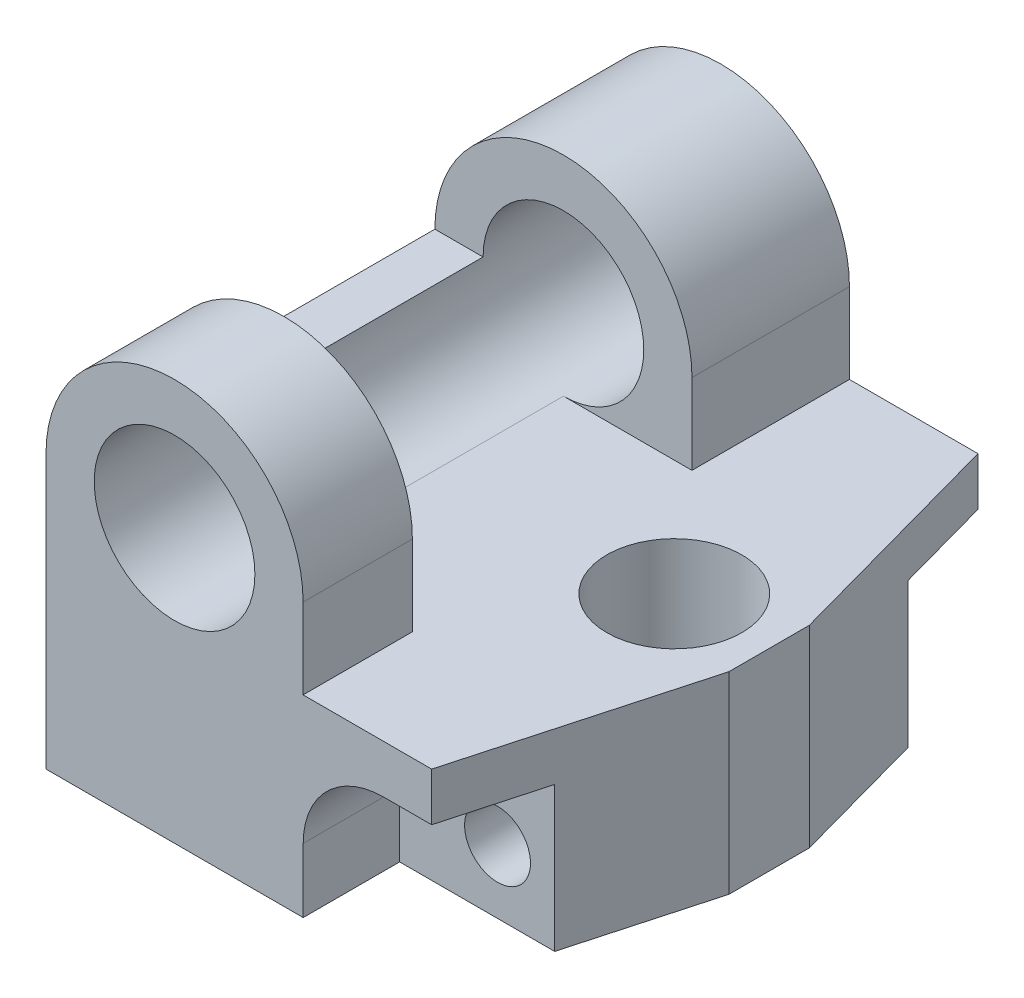
from build123d import *

# Parameters (mm, degrees)
SKETCH_1_R                = 2.5
EXTRUDE_1_DEPTH           = 8.5
CUT_EXTRUDE_1_DEPTH       = 17
CUT_EXTRUDE_2_DEPTH       = 3
FILLET_1_R                = 2.5
FILLET_1_OF_MIRROR_1_R    = 2.5
CUT_EXTRUDE_3_REACH       = 19.621
SKETCH_4_R                = 2.1
HOLE_WIZARD_M2_5_1_REACH  = 22.839
HOLE_WIZARD_M2_5_1_BORE_R = 1.025
CUT_EXTRUDE_4_REACH       = 22.839
CUT_EXTRUDE_4_END_RADIUS  = 2.1
SKETCH_9_R                = 1.425
CUT_EXTRUDE_5_DEPTH       = 5.1
CUT_EXTRUDE_6_DEPTH       = 3.6


with BuildPart() as part:
    # 草图1 → 凸台-拉伸1 (new, symmetric)
    with BuildSketch(Plane.XY):
        with BuildLine():
            Line((0, 0), (0, 2.5))
            ThreePointArc((0, 2.5), (4, 6.5), (8, 2.5))
            Line((8, 2.5), (8, 0))
            Line((8, 0), (14, 0))
            Line((14, 0), (14, -6))
            Line((14, -6), (0, -6))
            Line((0, -6), (0, 0))
        make_face()
        with Locations((4, 2.5)):
            Circle(SKETCH_1_R, mode=Mode.SUBTRACT)
    extrude(amount=EXTRUDE_1_DEPTH, both=True)

    # 草图2 → 切除-拉伸1 (cut)
    with BuildSketch(Plane(origin=(0, 0, 0), x_dir=(1, 0, 0), z_dir=(0, 1, 0))):
        Polygon((12, 8.5), (14, 1.25), (14, 8.5), align=None)
        Polygon((14, -8.5), (14, -1.25), (12, -8.5), align=None)
    extrude(amount=-CUT_EXTRUDE_1_DEPTH, mode=Mode.SUBTRACT)

    # 草图3 → 切除-拉伸2 (cut)
    with BuildSketch(Plane.XY.offset(8.5)):
        Polygon((12, -1.5), (8.003412896, -1.5), (8.003412896, -6), (8.003412896, -6.782168113), (14.44734693, -6.782168113), (14.44734693, -1.5), align=None)
    cut_extrude_2 = extrude(amount=-CUT_EXTRUDE_2_DEPTH, mode=Mode.SUBTRACT)

    # 圆角1
    fillet_1_edges = [part.edges().sort_by_distance(p)[0] for p in [
        (8.003412896, -1.5, 7),
    ]]
    fillet(fillet_1_edges, radius=FILLET_1_R)

    # 镜向1: 切除-拉伸2 across plane
    add(cut_extrude_2.mirror(Plane.XY), mode=Mode.SUBTRACT)

    # 圆角1 of 镜向1
    fillet_1_of_mirror_1_edges = [part.edges().sort_by_distance(p)[0] for p in [
        (8.003412896, -1.5, -7),
    ]]
    fillet(fillet_1_of_mirror_1_edges, radius=FILLET_1_OF_MIRROR_1_R)

    # 草图4 → 切除-拉伸3 (cut, up to next)
    with BuildSketch(Plane(origin=(0, 0, 0), x_dir=(1, 0, 0), z_dir=(0, 1, 0)), mode=Mode.PRIVATE) as cut_extrude_3_sk1:
        with Locations(Location((11.05, 0, 0), (0, 0, 270))):
            Circle(SKETCH_4_R)
    cut_extrude_3_tool1 = extrude(cut_extrude_3_sk1.sketch, amount=-CUT_EXTRUDE_3_REACH, mode=Mode.PRIVATE) & part.part
    add(cut_extrude_3_tool1.solids().sort_by_distance((11.05, 0, 0))[0], mode=Mode.SUBTRACT)

    # M2.5 螺纹孔1 bore → M2.5 螺纹孔1 (cut, up to next)
    with BuildSketch(Plane.XY.offset(5.5), mode=Mode.PRIVATE) as hole_wizard_m2_5_1_sk1:
        with Locations((11.05, -4)):
            Circle(HOLE_WIZARD_M2_5_1_BORE_R)
    hole_wizard_m2_5_1_tool1 = extrude(hole_wizard_m2_5_1_sk1.sketch, amount=-HOLE_WIZARD_M2_5_1_REACH, mode=Mode.PRIVATE) & part.part
    add(hole_wizard_m2_5_1_tool1.solids().sort_by_distance((11.05, -4, 5.5))[0], mode=Mode.SUBTRACT)

    # 切除-拉伸4: up to this cylinder (the profile starts outside it)
    cut_extrude_4_end = Plane(origin=(11.05, -4, 0), z_dir=(0, 1, 0)) * Cylinder(CUT_EXTRUDE_4_END_RADIUS, 50.878, mode=Mode.PRIVATE)
    # 草图9 → 切除-拉伸4 (cut, up to the surface)
    with BuildSketch(Plane(origin=(0, 0, -5.5), x_dir=(-1, 0, 0), z_dir=(0, 0, -1)), mode=Mode.PRIVATE) as cut_extrude_4_sk1:
        with Locations((-11.05, -4)):
            Circle(SKETCH_9_R)
    cut_extrude_4_tool1 = extrude(cut_extrude_4_sk1.sketch, amount=-CUT_EXTRUDE_4_REACH, mode=Mode.PRIVATE) - cut_extrude_4_end
    add(cut_extrude_4_tool1.solids().sort_by_distance((11.05, -4, -5.5))[0], mode=Mode.SUBTRACT)

    # 草图10 → 切除-拉伸5 (cut)
    with BuildSketch(Plane.XY):
        with BuildLine():
            Line((0, 2.5), (1.5, 2.5))
            ThreePointArc((1.5, 2.5), (5.767766953, 4.267766953), (4, 0))
            Line((4, 0), (8, 0))
            Line((8, 0), (8, 2.5))
            ThreePointArc((8, 2.5), (4, 6.5), (0, 2.5))
        make_face()
    extrude(amount=CUT_EXTRUDE_5_DEPTH, mode=Mode.SUBTRACT)

    # 草图10<2> → 切除-拉伸6 (cut)
    with BuildSketch(Plane.XY):
        with BuildLine():
            Line((0, 2.5), (1.5, 2.5))
            ThreePointArc((1.5, 2.5), (5.767766953, 4.267766953), (4, 0))
            Line((4, 0), (8, 0))
            Line((8, 0), (8, 2.5))
            ThreePointArc((8, 2.5), (4, 6.5), (0, 2.5))
        make_face()
    extrude(amount=-CUT_EXTRUDE_6_DEPTH, mode=Mode.SUBTRACT)


solid = part.part
